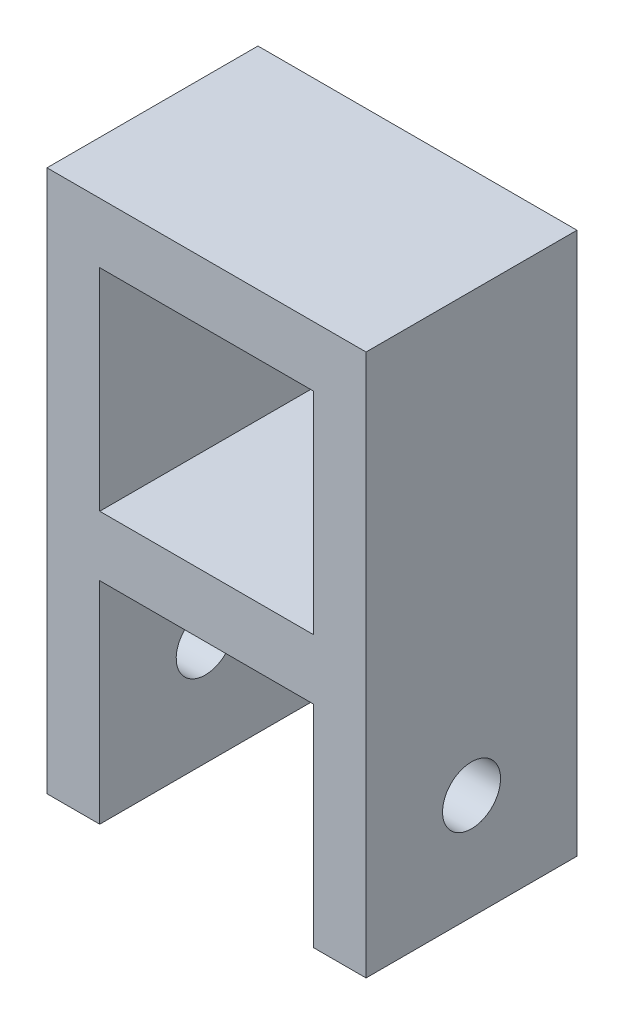
from build123d import *

# Parameters (mm, degrees)
SKETCH1_W               = 20.25
SKETCH1_H               = 20
BOSS_EXTRUDE1_DEPTH     = 20
CUT_EXTRUDE1_DEPTH      = 58.19025813
CUT_EXTRUDE1_DEPTH_BACK = 58.19025813
SKETCH2_R               = 2.75


with BuildPart() as part:
    # Sketch1 → Boss-Extrude1 (new body)
    with BuildSketch(Plane.XY):
        Polygon((-10.125, 0), (-10.125, 20), (10.125, 20), (10.125, 0), (15.125, 0), (15.125, 51.4), (-15.125, 51.4), (-15.125, 0), align=None)
        with Locations((0, 35.7)):
            Rectangle(SKETCH1_W, SKETCH1_H, mode=Mode.SUBTRACT)
    extrude(amount=BOSS_EXTRUDE1_DEPTH)

    # Sketch2 → Cut-Extrude1 (cut, two sides: drawn at the far end of the back side and taken through both)
    with BuildSketch(Plane(origin=(0, 0, 0), x_dir=(0, 0, -1), z_dir=(1, 0, 0)).offset(-CUT_EXTRUDE1_DEPTH_BACK)):
        with Locations((-10, 10)):
            Circle(SKETCH2_R)
    extrude(amount=CUT_EXTRUDE1_DEPTH + CUT_EXTRUDE1_DEPTH_BACK, mode=Mode.SUBTRACT)


solid = part.part
